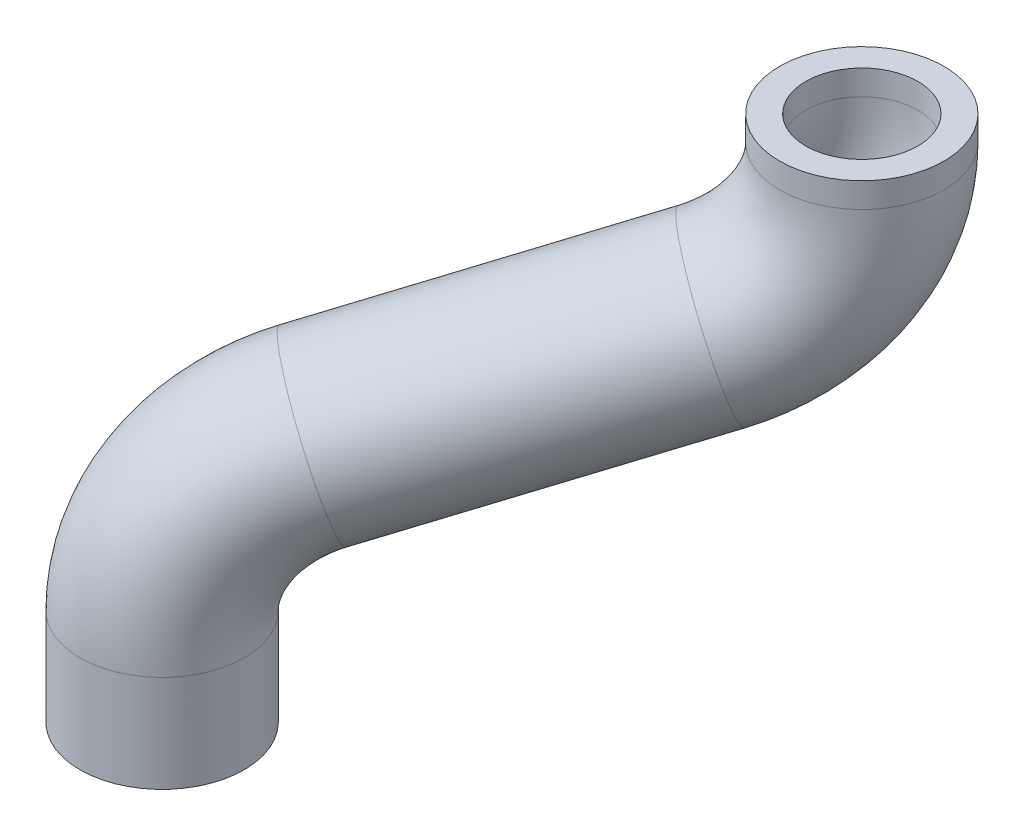
from build123d import *

# Parameters (mm, degrees)
SKETCH1_R   = 11
SKETCH1_R_2 = 7.5


with BuildPart() as part:
    # Sweep1: sweep along a curve in space
    with BuildLine() as sweep1_path:
        Line((-278.808582713, 47.694450414, 105.885812847), (-278.808582713, 60.677606096, 105.885812847))
        ThreePointArc((-278.808582713, 60.677606096, 105.885812847), (-276.236491838, 72.731221393, 102.873360726), (-269.523012132, 80.085438161, 95.01048295))
        Line((-269.523012132, 80.085438161, 95.01048295), (-244.95002758, 91.823545196, 66.23041917))
        ThreePointArc((-244.95002758, 91.823545196, 66.23041917), (-238.236547874, 99.177761965, 58.367541394), (-235.664456999, 111.231377261, 55.355089273))
        Line((-235.664456999, 114.569170274, 55.355089273), (-235.664456999, 111.231377261, 55.355089273))
    # Sketch1 → Sweep1 (sweep)
    with BuildSketch(Plane(origin=(-278.808582713, 47.694450414, 105.885812847), x_dir=(1, 0, 0), z_dir=(0, 1, 0))):
        Circle(SKETCH1_R)
        Circle(SKETCH1_R_2, mode=Mode.SUBTRACT)
    sweep(path=sweep1_path.line)


solid = part.part
